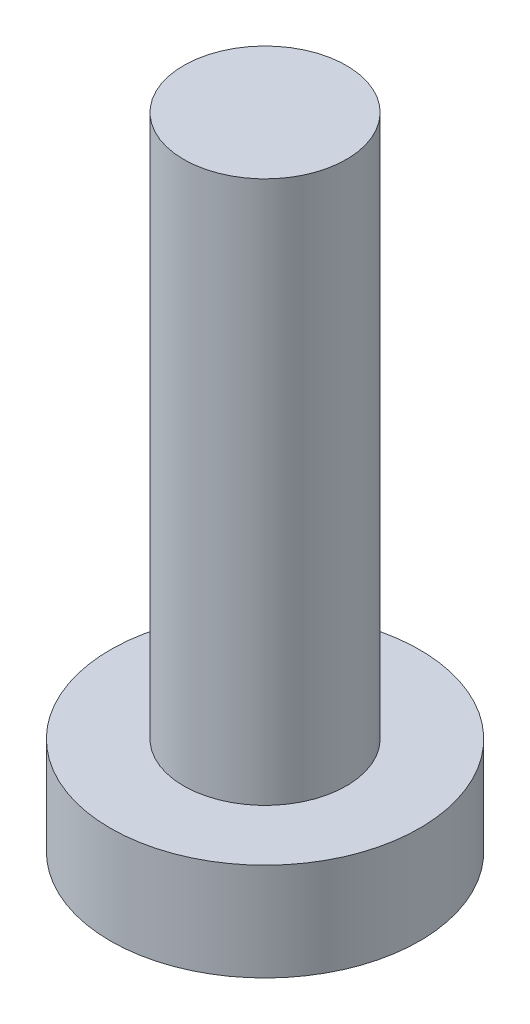
from build123d import *

# Parameters (mm, degrees)
CUT_EXTRUDE_1_DEPTH = 1.5


with BuildPart() as part:
    # 草图1 → 旋转1 (revolve)
    with BuildSketch(Plane.XY, mode=Mode.PRIVATE) as revolve_1_sk:
        Polygon((0, 0), (2.85, 0), (2.85, 1.8), (1.5, 1.8), (1.5, 11.8), (0, 11.8), align=None)
    revolve(revolve_1_sk.sketch.rotate(Axis((0, 5.079324982, 0), (0, -1, 0)), 90), axis=Axis((0, 5.079324982, 0), (0, -1, 0)))

    # 草图2 → 切除-拉伸1 (cut)
    with BuildSketch(Plane.XZ):
        Polygon((0, -1.425), (1.2340862, -0.7125), (1.2340862, 0.7125), (0, 1.425), (-1.2340862, 0.7125), (-1.2340862, -0.7125), align=None)
    extrude(amount=-CUT_EXTRUDE_1_DEPTH, mode=Mode.SUBTRACT)


solid = part.part
